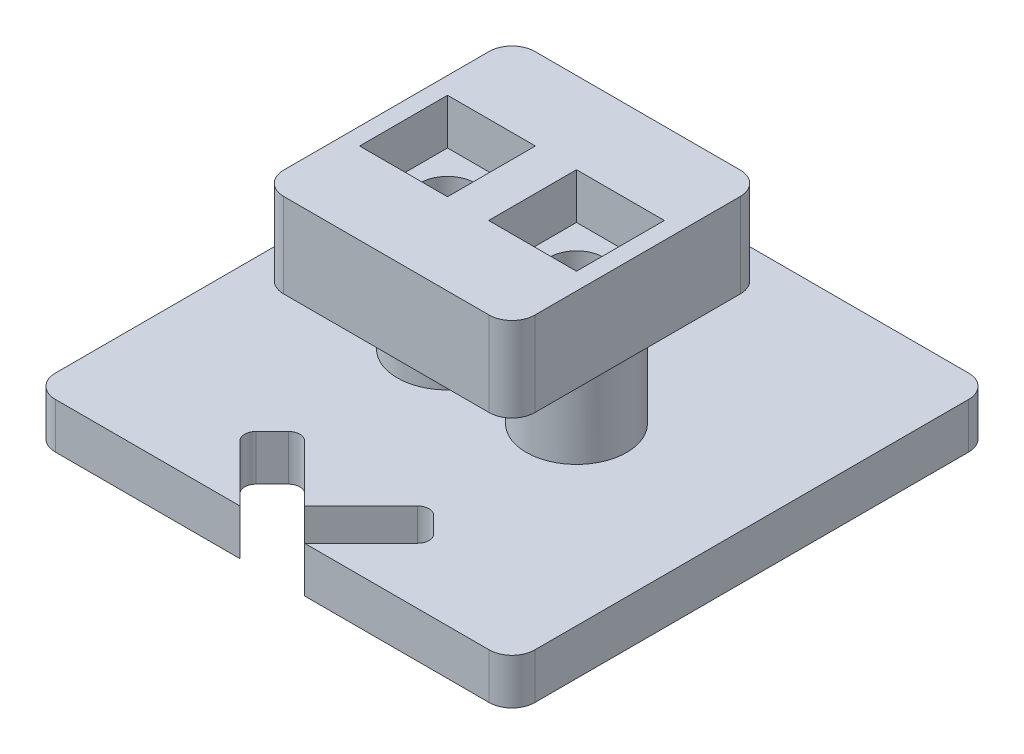
from build123d import *

# Parameters (mm, degrees)
SKETCH1_W           = 11
SKETCH1_H           = 11
BOSS_EXTRUDE1_DEPTH = 3.7
FILLET1_R           = 1
SKETCH2_W           = 3.85
SKETCH2_H           = 3.85
CUT_EXTRUDE1_DEPTH  = 2
SKETCH4_R           = 2.2
BOSS_EXTRUDE2_DEPTH = 6
BOSS_EXTRUDE3_DEPTH = 2
SKETCH3_R           = 1.2
CUT_EXTRUDE2_DEPTH  = 18.736685147
CUT_EXTRUDE3_DEPTH  = 17.726924403


with BuildPart() as part:
    # Sketch1 → Boss-Extrude1 (new body)
    with BuildSketch(Plane(origin=(0, 0, 0), x_dir=(1, 0, 0), z_dir=(0, 1, 0))):
        Rectangle(SKETCH1_W, SKETCH1_H)
    extrude(amount=BOSS_EXTRUDE1_DEPTH)

    # Fillet1
    fillet1_edges = [part.edges().sort_by_distance(p)[0] for p in [
        (5.5, 1.85, 5.5),
        (-5.5, 1.85, 5.5),
        (-5.5, 1.85, -5.5),
        (5.5, 1.85, -5.5),
    ]]
    fillet(fillet1_edges, radius=FILLET1_R)

    # Sketch2 → Cut-Extrude1 (cut)
    with BuildSketch(Plane(origin=(0, 3.7, 0), x_dir=(1, 0, 0), z_dir=(0, 1, 0))):
        with Locations((-2.825, 0)):
            Rectangle(SKETCH2_W, SKETCH2_H)
        with Locations((2.825, 0)):
            Rectangle(SKETCH2_W, SKETCH2_H)
    extrude(amount=-CUT_EXTRUDE1_DEPTH, mode=Mode.SUBTRACT)

    # Sketch4 → Boss-Extrude2 (add)
    with BuildSketch(Plane(origin=(0, 0, 0), x_dir=(-1, 0, 0), z_dir=(0, -1, 0))):
        with Locations(Location((2.825, 0, 0), (0, 0, 90))):
            Circle(SKETCH4_R)
        with Locations(Location((-2.825, 0, 0), (0, 0, 90))):
            Circle(SKETCH4_R)
    extrude(amount=BOSS_EXTRUDE2_DEPTH)

    # Sketch5 → Boss-Extrude3 (add)
    with BuildSketch(Plane(origin=(0, -6, 0), x_dir=(-1, 0, 0), z_dir=(0, -1, 0))):
        with BuildLine():
            Line((9.5, 10.5), (-9.5, 10.5))
            ThreePointArc((-9.5, 10.5), (-10.207106781, 10.207106781), (-10.5, 9.5))
            Line((-10.5, 9.5), (-10.5, -9.5))
            ThreePointArc((-10.5, -9.5), (-10.207106781, -10.207106781), (-9.5, -10.5))
            Line((-9.5, -10.5), (9.5, -10.5))
            ThreePointArc((9.5, -10.5), (10.207106781, -10.207106781), (10.5, -9.5))
            Line((10.5, -9.5), (10.5, 9.5))
            ThreePointArc((10.5, 9.5), (10.207106781, 10.207106781), (9.5, 10.5))
        make_face()
    extrude(amount=-BOSS_EXTRUDE3_DEPTH)

    # Sketch3 → Cut-Extrude2 (cut, through all)
    with BuildSketch(Plane(origin=(0, 3.7, 0), x_dir=(1, 0, 0), z_dir=(0, 1, 0))):
        with Locations(Location((-2.825, 0, 0), (0, 0, 270))):
            Circle(SKETCH3_R)
        with Locations(Location((2.825, 0, 0), (0, 0, 270))):
            Circle(SKETCH3_R)
    extrude(amount=-CUT_EXTRUDE2_DEPTH, mode=Mode.SUBTRACT)

    # Sketch7 → Cut-Extrude3 (cut, through all)
    with BuildSketch(Plane(origin=(0, -4, 0), x_dir=(1, 0, 0), z_dir=(0, 1, 0))):
        with BuildLine():
            Line((0, -9.085786438), (1.414213562, -10.5))
            Line((1.414213562, -10.5), (3.889087297, -8.025126266))
            ThreePointArc((3.889087297, -8.025126266), (4.035533906, -7.671572875), (3.889087297, -7.318019485))
            Line((3.889087297, -7.318019485), (3.181980515, -6.610912703))
            ThreePointArc((3.181980515, -6.610912703), (2.828427125, -6.464466094), (2.474873734, -6.610912703))
            Line((2.474873734, -6.610912703), (0, -9.085786438))
        make_face()
        with BuildLine():
            Line((-3.889087297, -8.025126266), (-1.414213562, -10.5))
            Line((-1.414213562, -10.5), (0, -9.085786438))
            Line((0, -9.085786438), (-2.474873734, -6.610912703))
            ThreePointArc((-2.474873734, -6.610912703), (-2.828427125, -6.464466094), (-3.181980515, -6.610912703))
            Line((-3.181980515, -6.610912703), (-3.889087297, -7.318019485))
            ThreePointArc((-3.889087297, -7.318019485), (-4.035533906, -7.671572875), (-3.889087297, -8.025126266))
        make_face()
        Polygon((-1.414213562, -10.5), (1.414213562, -10.5), (0, -9.085786438), align=None)
    extrude(amount=-CUT_EXTRUDE3_DEPTH, mode=Mode.SUBTRACT)


solid = part.part
